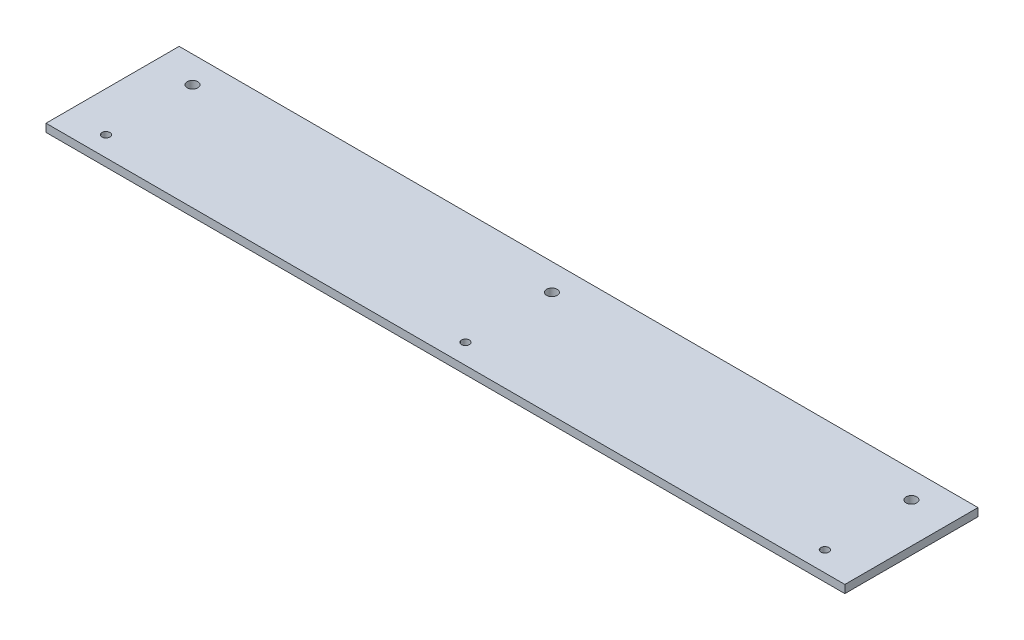
from build123d import *

# Parameters (mm, degrees)
SKETCH1_W           = 300
SKETCH1_H           = 50
SKETCH1_R           = 2
SKETCH1_R_2         = 1.5
BOSS_EXTRUDE1_DEPTH = 3


with BuildPart() as part:
    # Sketch1 → Boss-Extrude1 (new body)
    with BuildSketch(Plane(origin=(0, 0, 0), x_dir=(1, 0, 0), z_dir=(0, 1, 0))):
        with Locations((150, 25)):
            Rectangle(SKETCH1_W, SKETCH1_H)
        with Locations(Location((15, 40, 0), (0, 0, 270))):
            Circle(SKETCH1_R, mode=Mode.SUBTRACT)
        with Locations(Location((150, 40, 0), (0, 0, 270))):
            Circle(SKETCH1_R, mode=Mode.SUBTRACT)
        with Locations(Location((285, 40, 0), (0, 0, 270))):
            Circle(SKETCH1_R, mode=Mode.SUBTRACT)
        with Locations(Location((15, 7.5, 0), (0, 0, 270))):
            Circle(SKETCH1_R_2, mode=Mode.SUBTRACT)
        with Locations(Location((150, 7.5, 0), (0, 0, 270))):
            Circle(SKETCH1_R_2, mode=Mode.SUBTRACT)
        with Locations(Location((285, 7.5, 0), (0, 0, 270))):
            Circle(SKETCH1_R_2, mode=Mode.SUBTRACT)
    extrude(amount=BOSS_EXTRUDE1_DEPTH)


solid = part.part
